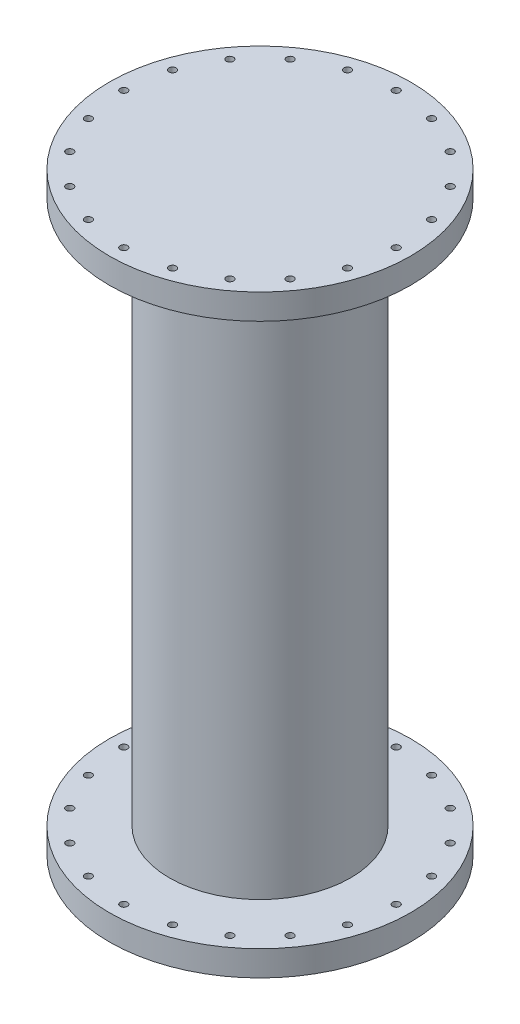
from build123d import *

# Parameters (mm, degrees)
ESQUISSE2_R                  = 10
ENL_V_MAT_EXTRU_1_DEPTH      = 1743.329475157
R_P_TITION_CIRCULAIRE1_COUNT = 20


with BuildPart() as part:
    # Esquisse1 → Révolution1 (revolve)
    with BuildSketch(Plane.XY, mode=Mode.PRIVATE) as r_volution1_sk:
        Polygon((0, 0), (416, 0), (416, -70), (250, -70), (250, -1570), (416, -1570), (416, -1640), (0, -1640), (0, -1570), (200, -1570), (200, -70), (0, -70), align=None)
    revolve(r_volution1_sk.sketch.rotate(Axis((0, 0, 0), (0, -1, 0)), 180), axis=Axis((0, 0, 0), (0, -1, 0)))

    # Esquisse2 → Enlèv. mat.-Extru.1 (cut, through all)
    with BuildSketch(Plane(origin=(0, 0, 0), x_dir=(1, 0, 0), z_dir=(0, 1, 0))):
        with Locations(Location((376, 0, 0), (0, 0, 180))):
            Circle(ESQUISSE2_R)
    enl_v_mat_extru_1 = extrude(amount=-ENL_V_MAT_EXTRU_1_DEPTH, mode=Mode.SUBTRACT)

    # Répétition circulaire1: Enlèv. mat.-Extru.1 ×20 about axis
    r_p_tition_circulaire1_axis = Axis((0, 0, 0), (0, 1, 0))
    for i in range(1, R_P_TITION_CIRCULAIRE1_COUNT):
        add(enl_v_mat_extru_1.rotate(r_p_tition_circulaire1_axis, i * 360 / R_P_TITION_CIRCULAIRE1_COUNT), mode=Mode.SUBTRACT)


solid = part.part
